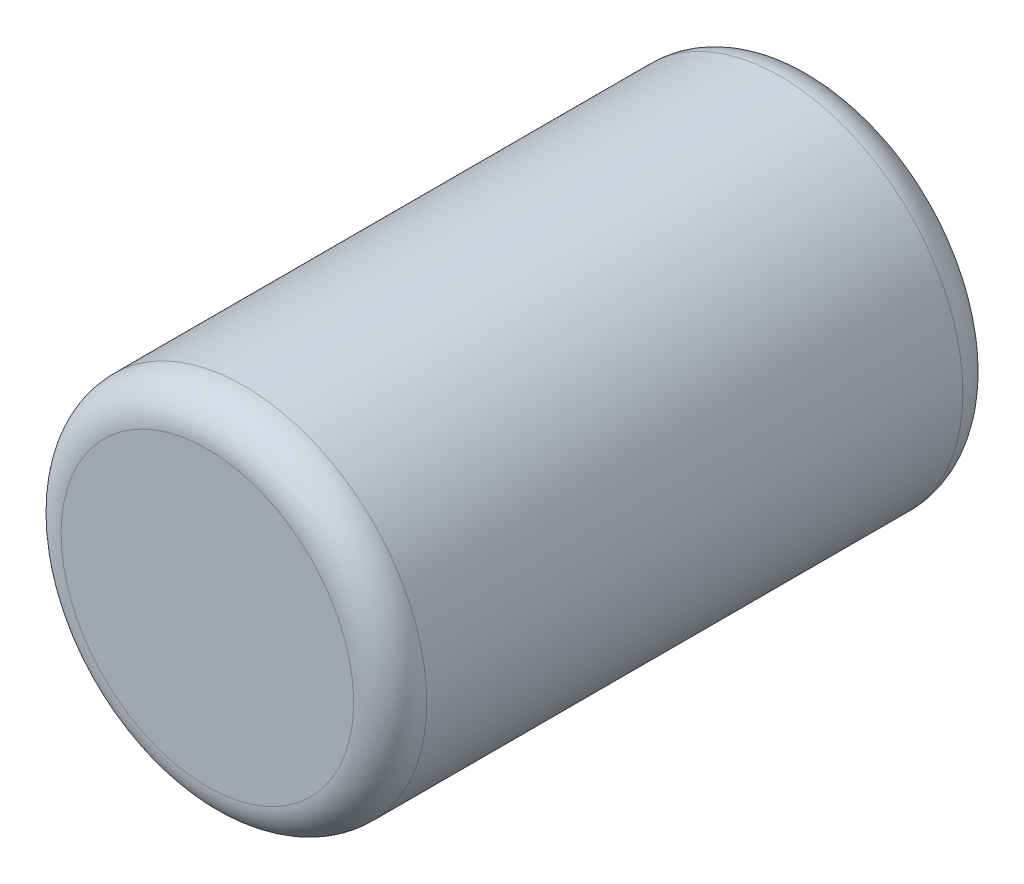
from build123d import *


with BuildPart() as part:
    # Эскиз1 → Повернуть1 (revolve)
    with BuildSketch(Plane(origin=(0, 0, 0), x_dir=(0, 0, -1), z_dir=(1, 0, 0)), mode=Mode.PRIVATE) as revolve_1_sk:
        with BuildLine():
            Line((0, 0), (-5, 0))
            Line((-5, 0), (-5, -1.2))
            ThreePointArc((-5, -1.2), (-4.912132034, -1.412132034), (-4.7, -1.5))
            Line((-4.7, -1.5), (-0.3, -1.5))
            ThreePointArc((-0.3, -1.5), (-0.087867966, -1.412132034), (0, -1.2))
            Line((0, -1.2), (0, 0))
        make_face()
    revolve(revolve_1_sk.sketch.rotate(Axis((0, 0, 0), (0, 0, 1)), 270), axis=Axis((0, 0, 0), (0, 0, 1)))


solid = part.part
